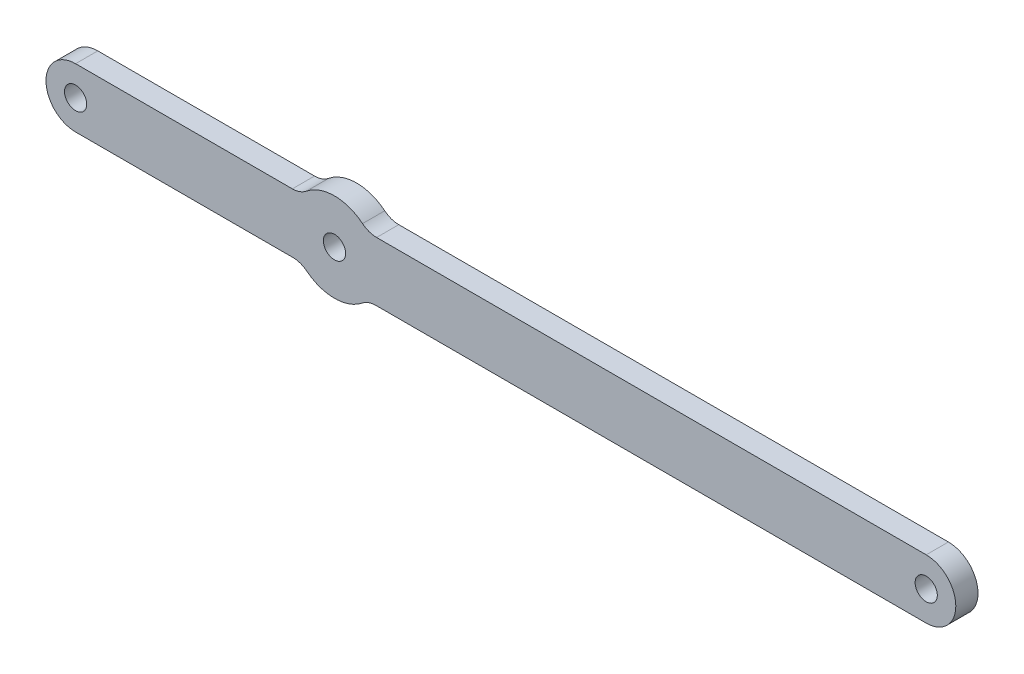
from build123d import *

# Parameters (mm, degrees)
ESQUISSE15_R        = 1.5
BOSS_EXTRU_15_DEPTH = 3


with BuildPart() as part:
    # Esquisse15 → Boss.-Extru.15 (new body)
    with BuildSketch(Plane.XY):
        with BuildLine():
            Line((101.910180697, 77.71752531), (131.216827386, 77.71752531))
            ThreePointArc((131.216827386, 77.71752531), (132.224213524, 77.891720439), (133.114611823, 78.394076531))
            ThreePointArc((133.114611823, 78.394076531), (136.910180697, 79.747178972), (140.705749571, 78.394076531))
            ThreePointArc((140.705749571, 78.394076531), (141.59614787, 77.891720439), (142.603534008, 77.71752531))
            Line((142.603534008, 77.71752531), (216.910180697, 77.71752531))
            ThreePointArc((216.910180697, 77.71752531), (220.910180697, 73.71752531), (216.910180697, 69.71752531))
            Line((216.910180697, 69.71752531), (142.530142387, 69.71752531))
            ThreePointArc((142.530142387, 69.71752531), (141.537583488, 69.54857226), (140.656821824, 69.060743198))
            ThreePointArc((140.656821824, 69.060743198), (136.910180697, 67.747178972), (133.16353957, 69.060743198))
            ThreePointArc((133.16353957, 69.060743198), (132.282777907, 69.54857226), (131.290219007, 69.71752531))
            Line((131.290219007, 69.71752531), (101.910180697, 69.71752531))
            ThreePointArc((101.910180697, 69.71752531), (97.910180697, 73.71752531), (101.910180697, 77.71752531))
        make_face()
        with Locations((101.910180697, 73.71752531)):
            Circle(ESQUISSE15_R, mode=Mode.SUBTRACT)
        with Locations((216.910180697, 73.71752531)):
            Circle(ESQUISSE15_R, mode=Mode.SUBTRACT)
        with Locations((136.910180697, 73.747178972)):
            Circle(ESQUISSE15_R, mode=Mode.SUBTRACT)
    extrude(amount=BOSS_EXTRU_15_DEPTH)


solid = part.part
